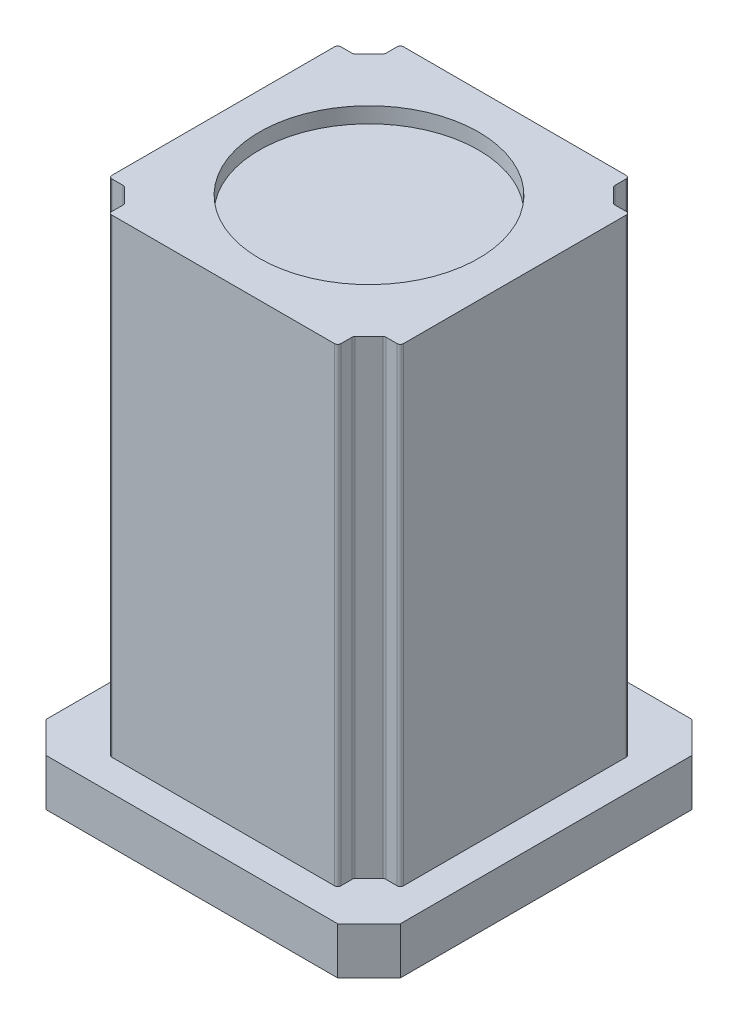
from build123d import *

# Parameters (mm, degrees)
BOSS_EXTRUDE1_DEPTH = 15
BOSS_EXTRUDE2_DEPTH = 150
FILLET1_R           = 1
SKETCH3_R           = 35
CUT_EXTRUDE1_DEPTH  = 5


with BuildPart() as part:
    # Sketch1 → Boss-Extrude1 (new body)
    with BuildSketch(Plane(origin=(0, 0, 0), x_dir=(1, 0, 0), z_dir=(0, 1, 0))):
        Polygon((-56.565, 46.565), (-46.565, 56.565), (46.565, 56.565), (56.565, 46.565), (56.565, -46.565), (46.565, -56.565), (-46.565, -56.565), (-56.565, -46.565), align=None)
    extrude(amount=BOSS_EXTRUDE1_DEPTH)

    # Sketch2 → Boss-Extrude2 (add)
    with BuildSketch(Plane(origin=(0, 15, 0), x_dir=(1, 0, 0), z_dir=(0, 1, 0))):
        Polygon((36.565, 46.565), (36.565, 41.565), (41.565, 36.565), (46.565, 36.565), (46.565, -36.565), (41.565, -36.565), (36.565, -41.565), (36.565, -46.565), (-36.565, -46.565), (-36.565, -41.565), (-41.565, -36.565), (-46.565, -36.565), (-46.565, 36.565), (-41.565, 36.565), (-36.565, 41.565), (-36.565, 46.565), align=None)
    extrude(amount=BOSS_EXTRUDE2_DEPTH)

    # Fillet1
    fillet1_edges = [part.edges().sort_by_distance(p)[0] for p in [
        (36.565, 90, -46.565),
        (-36.565, 90, -46.565),
        (-36.565, 90, -41.565),
        (-41.565, 90, -36.565),
        (-46.565, 90, -36.565),
        (-46.565, 90, 36.565),
        (-41.565, 90, 36.565),
        (-36.565, 90, 41.565),
        (-36.565, 90, 46.565),
        (36.565, 90, 46.565),
        (36.565, 90, 41.565),
        (41.565, 90, 36.565),
        (46.565, 90, 36.565),
        (46.565, 90, -36.565),
        (41.565, 90, -36.565),
        (36.565, 90, -41.565),
    ]]
    fillet(fillet1_edges, radius=FILLET1_R)

    # Sketch3 → Cut-Extrude1 (cut)
    with BuildSketch(Plane(origin=(0, 165, 0), x_dir=(1, 0, 0), z_dir=(0, 1, 0))):
        with Locations(Location((0, 0, 0), (0, 0, 270))):
            Circle(SKETCH3_R)
    extrude(amount=-CUT_EXTRUDE1_DEPTH, mode=Mode.SUBTRACT)


solid = part.part
